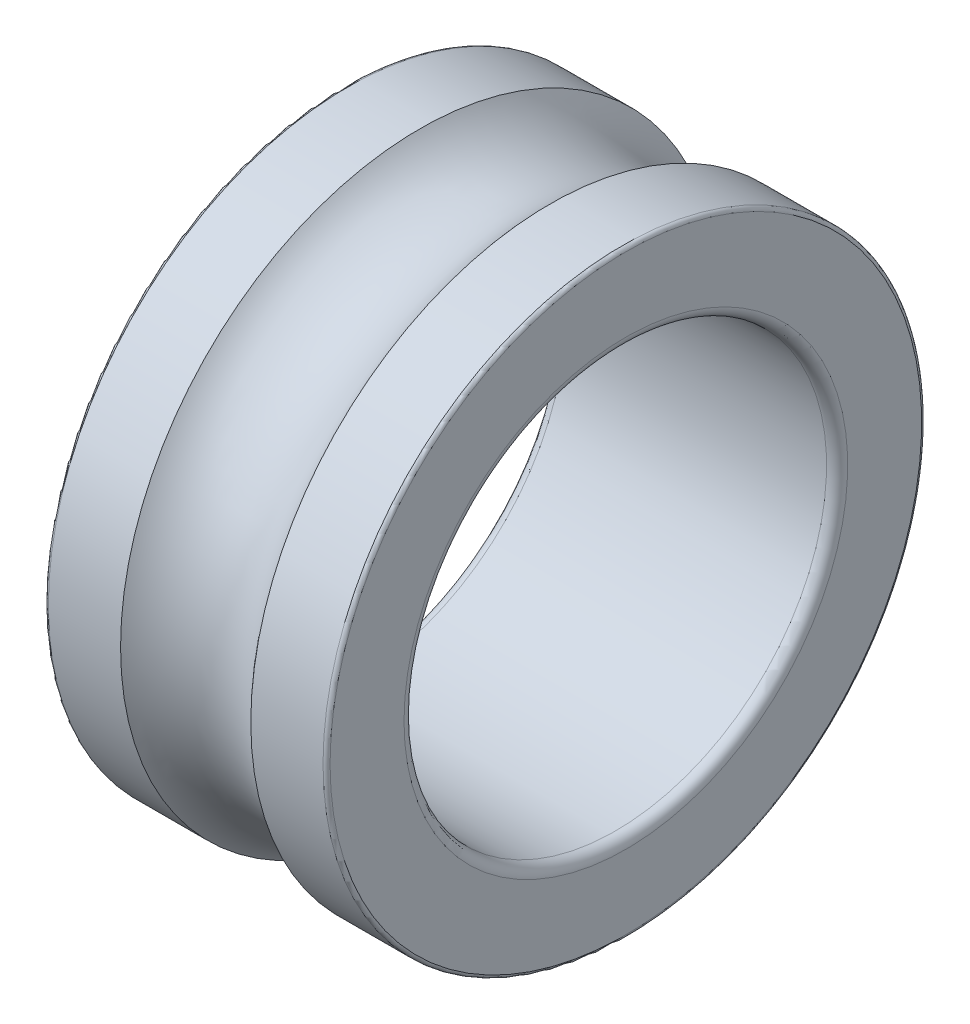
from build123d import *


with BuildPart() as part:
    # Esquisse1 → Révolution1 (revolve)
    with BuildSketch(Plane.XY, mode=Mode.PRIVATE) as r_volution1_sk:
        with BuildLine():
            Line((0.3, 6), (7.7, 6))
            ThreePointArc((7.7, 6), (7.912132034, 6.087867966), (8, 6.3))
            Line((8, 6.3), (8, 8.4))
            ThreePointArc((8, 8.4), (7.970710678, 8.470710678), (7.9, 8.5))
            Line((7.9, 8.5), (5.849097347, 8.5))
            ThreePointArc((5.849097347, 8.5), (4, 7.619), (2.150902653, 8.5))
            Line((2.150902653, 8.5), (0.1, 8.5))
            ThreePointArc((0.1, 8.5), (0.029289322, 8.470710678), (0, 8.4))
            Line((0, 8.4), (0, 6.3))
            ThreePointArc((0, 6.3), (0.087867966, 6.087867966), (0.3, 6))
        make_face()
    revolve(r_volution1_sk.sketch.rotate(Axis((100, 0, 0), (-1, 0, 0)), 270), axis=Axis((100, 0, 0), (-1, 0, 0)))


solid = part.part
